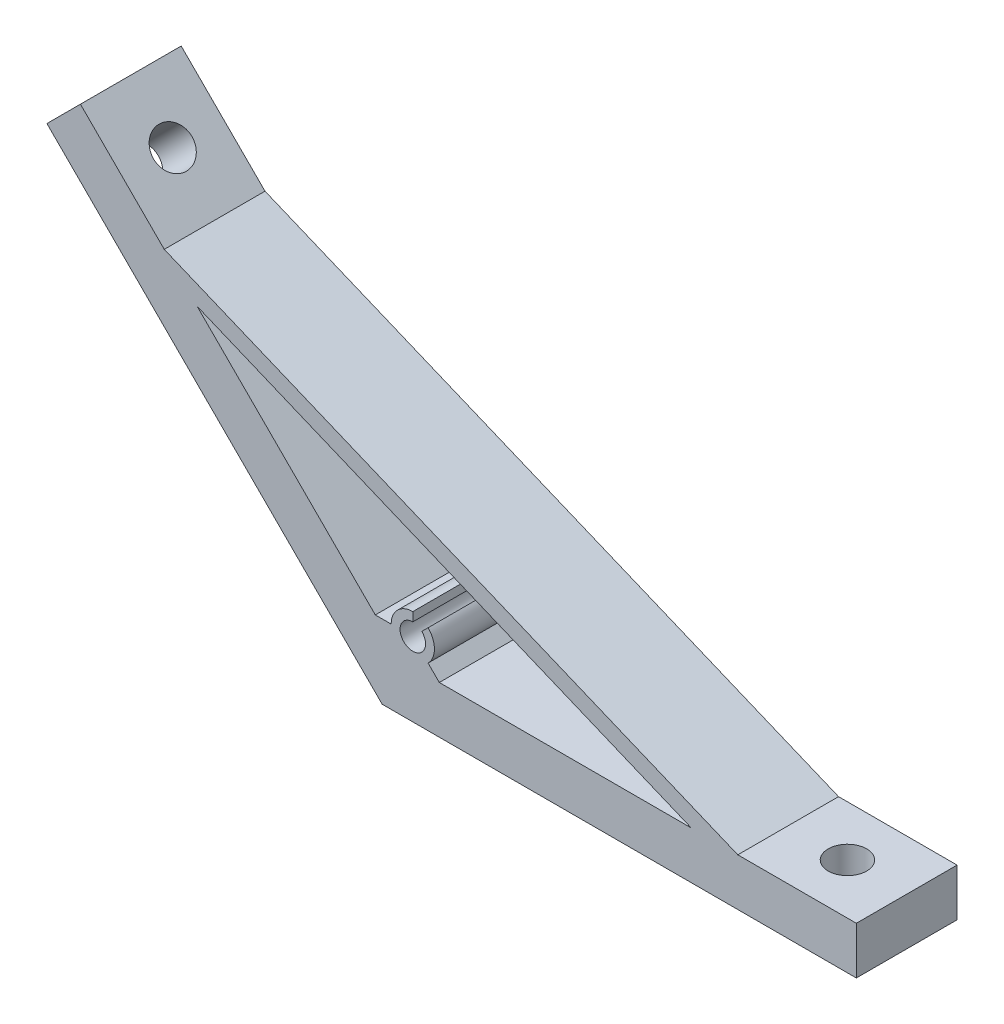
from build123d import *

# Parameters (mm, degrees)
EXTRUDE_1_DEPTH     = 8.5
SKETCH_3_R          = 3.25
CUT_EXTRUDE_1_DEPTH = 98.018779894


with BuildPart() as part:
    # 草图1 → 凸台-拉伸1 (new, symmetric)
    with BuildSketch(Plane.XY):
        Polygon((80, 0), (0, 0), (-56.568542495, 56.568542495), (-50.911688245, 62.225396744), (-36.769552622, 48.083261121), (60, 8), (80, 8), align=None)
        with BuildLine():
            Line((52.160622211, 8), (9.638600026, 8))
            Line((9.638600026, 8), (7.747166088, 9.891433938))
            ThreePointArc((7.747166088, 9.891433938), (8.816226337, 12.472373689), (7.747166088, 15.05331344))
            Line((7.747166088, 15.05331344), (6.686505916, 13.992653268))
            ThreePointArc((6.686505916, 13.992653268), (4.343456957, 10.486032694), (5.166226337, 14.622373689))
            Line((5.166226337, 14.622373689), (5.166226337, 16.122373689))
            ThreePointArc((5.166226337, 16.122373689), (2.585286586, 15.05331344), (1.516226337, 12.472373689))
            Line((1.516226337, 12.472373689), (-1.15866519, 12.472373689))
            Line((-1.15866519, 12.472373689), (-31.226275427, 42.539983926))
            Line((-31.226275427, 42.539983926), (52.160622211, 8))
        make_face(mode=Mode.SUBTRACT)
    extrude(amount=EXTRUDE_1_DEPTH, both=True)

    # 草图3 → 切除-拉伸1 (cut, through all)
    with BuildSketch(Plane(origin=(0, 8, 0), x_dir=(1, 0, 0), z_dir=(0, 1, 0))):
        with Locations(Location((70, 0, 0), (0, 0, 180))):
            Circle(SKETCH_3_R)
    cut_extrude_1 = extrude(amount=-CUT_EXTRUDE_1_DEPTH, mode=Mode.SUBTRACT)

    # 镜向1: 切除-拉伸1 across plane
    add(cut_extrude_1.mirror(Plane(origin=(0, 0, 0), x_dir=(0, 0, 1), z_dir=(-0.9238795325112867, 0.3826834323650898, 0))), mode=Mode.SUBTRACT)


solid = part.part
